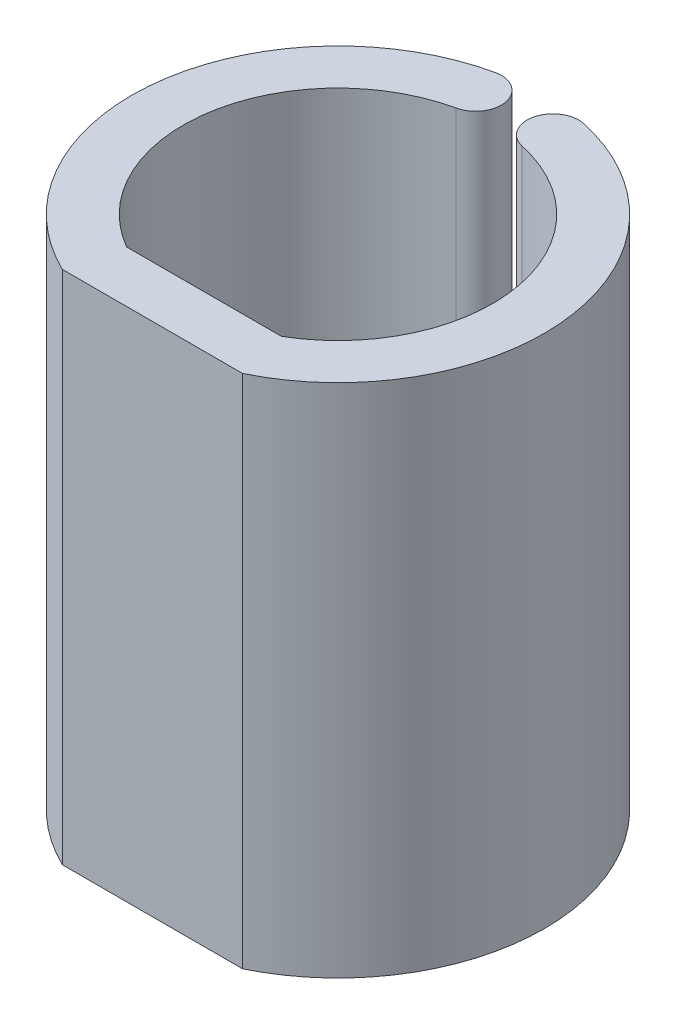
from build123d import *

# Parameters (mm, degrees)
BOSS_EXTRUDE1_DEPTH = 5


with BuildPart() as part:
    # Sketch1 → Boss-Extrude1 (new, symmetric)
    with BuildSketch(Plane(origin=(0, 0, 0), x_dir=(1, 0, 0), z_dir=(0, 1, 0))):
        with BuildLine():
            Line((1.5, 0), (-1.5, 0))
            ThreePointArc((-1.5, 0), (-2.96457943, 3.057716073), (-0.642857143, 5.528389282))
            ThreePointArc((-0.642857143, 5.528389282), (-0.261614488, 6.123917651), (-0.857142857, 6.505160306))
            ThreePointArc((-0.857142857, 6.505160306), (-3.972144627, 3.069316131), (-1.747526131, -1))
            Line((-1.747526131, -1), (1.747526131, -1))
            ThreePointArc((1.747526131, -1), (3.972144627, 3.069316131), (0.857142857, 6.505160306))
            ThreePointArc((0.857142857, 6.505160306), (0.261614488, 6.123917651), (0.642857143, 5.528389282))
            ThreePointArc((0.642857143, 5.528389282), (2.96457943, 3.057716073), (1.5, 0))
        make_face()
    extrude(amount=BOSS_EXTRUDE1_DEPTH, both=True)


solid = part.part
